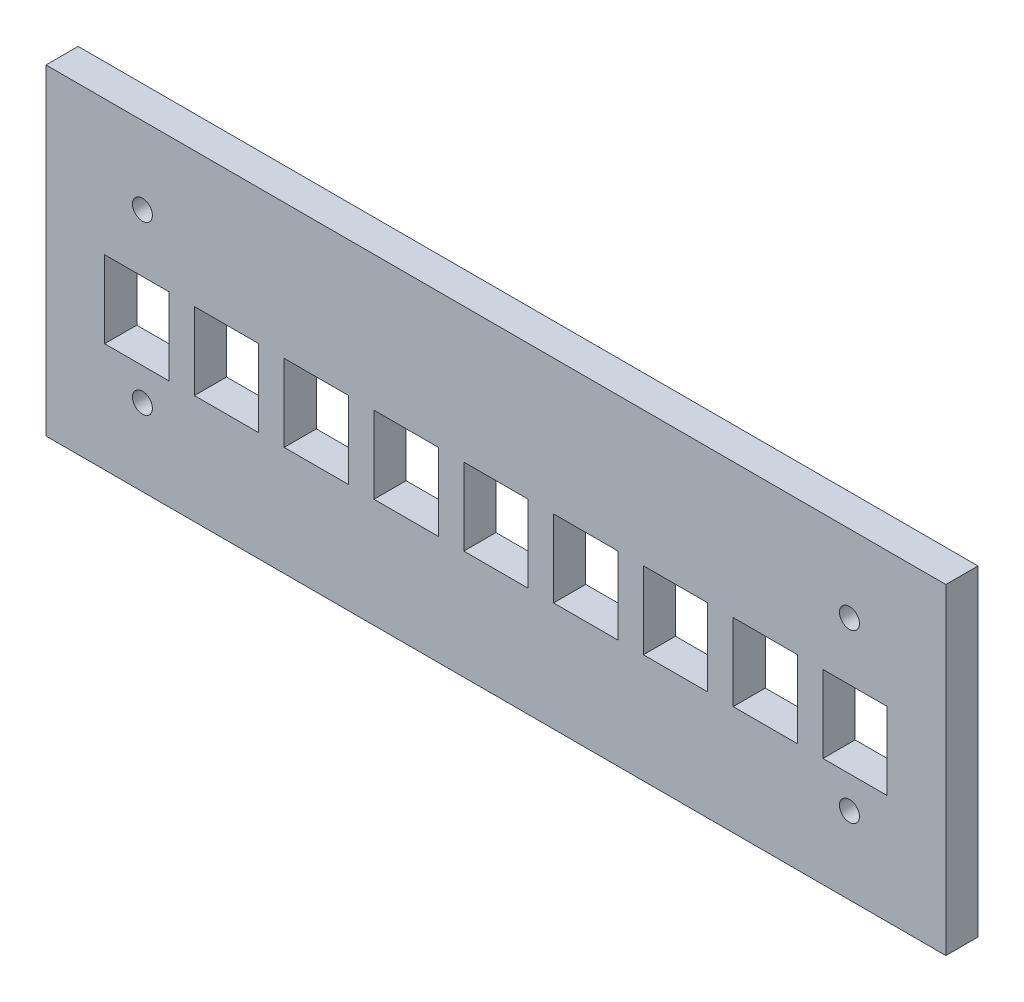
from build123d import *

# Parameters (mm, degrees)
ESQUISSE1_W        = 140
ESQUISSE1_H        = 50
ESQUISSE1_R        = 1.55
ESQUISSE1_W_2      = 10
ESQUISSE1_H_2      = 12
BOSS_EXTRU_1_DEPTH = 5


with BuildPart() as part:
    # Esquisse1 → Boss.-Extru.1 (new body)
    with BuildSketch(Plane.XY):
        Rectangle(ESQUISSE1_W, ESQUISSE1_H)
        with Locations((-55, -13)):
            Circle(ESQUISSE1_R, mode=Mode.SUBTRACT)
        with Locations(Location((-55, 13, 0), (0, 0, 180))):
            Circle(ESQUISSE1_R, mode=Mode.SUBTRACT)
        with Locations(Location((55, -13, 0), (0, 0, 180))):
            Circle(ESQUISSE1_R, mode=Mode.SUBTRACT)
        with Locations((55, 13)):
            Circle(ESQUISSE1_R, mode=Mode.SUBTRACT)
        with Locations((13.97, -2)):
            Rectangle(ESQUISSE1_W_2, ESQUISSE1_H_2, mode=Mode.SUBTRACT)
        with Locations((0, -2)):
            Rectangle(ESQUISSE1_W_2, ESQUISSE1_H_2, mode=Mode.SUBTRACT)
        with Locations((27.94, -2)):
            Rectangle(ESQUISSE1_W_2, ESQUISSE1_H_2, mode=Mode.SUBTRACT)
        with Locations((41.91, -2)):
            Rectangle(ESQUISSE1_W_2, ESQUISSE1_H_2, mode=Mode.SUBTRACT)
        with Locations((55.88, -2)):
            Rectangle(ESQUISSE1_W_2, ESQUISSE1_H_2, mode=Mode.SUBTRACT)
        with Locations((-13.97, -2)):
            Rectangle(ESQUISSE1_W_2, ESQUISSE1_H_2, mode=Mode.SUBTRACT)
        with Locations((-27.94, -2)):
            Rectangle(ESQUISSE1_W_2, ESQUISSE1_H_2, mode=Mode.SUBTRACT)
        with Locations((-41.91, -2)):
            Rectangle(ESQUISSE1_W_2, ESQUISSE1_H_2, mode=Mode.SUBTRACT)
        with Locations((-55.88, -2)):
            Rectangle(ESQUISSE1_W_2, ESQUISSE1_H_2, mode=Mode.SUBTRACT)
    extrude(amount=-BOSS_EXTRU_1_DEPTH)


solid = part.part
